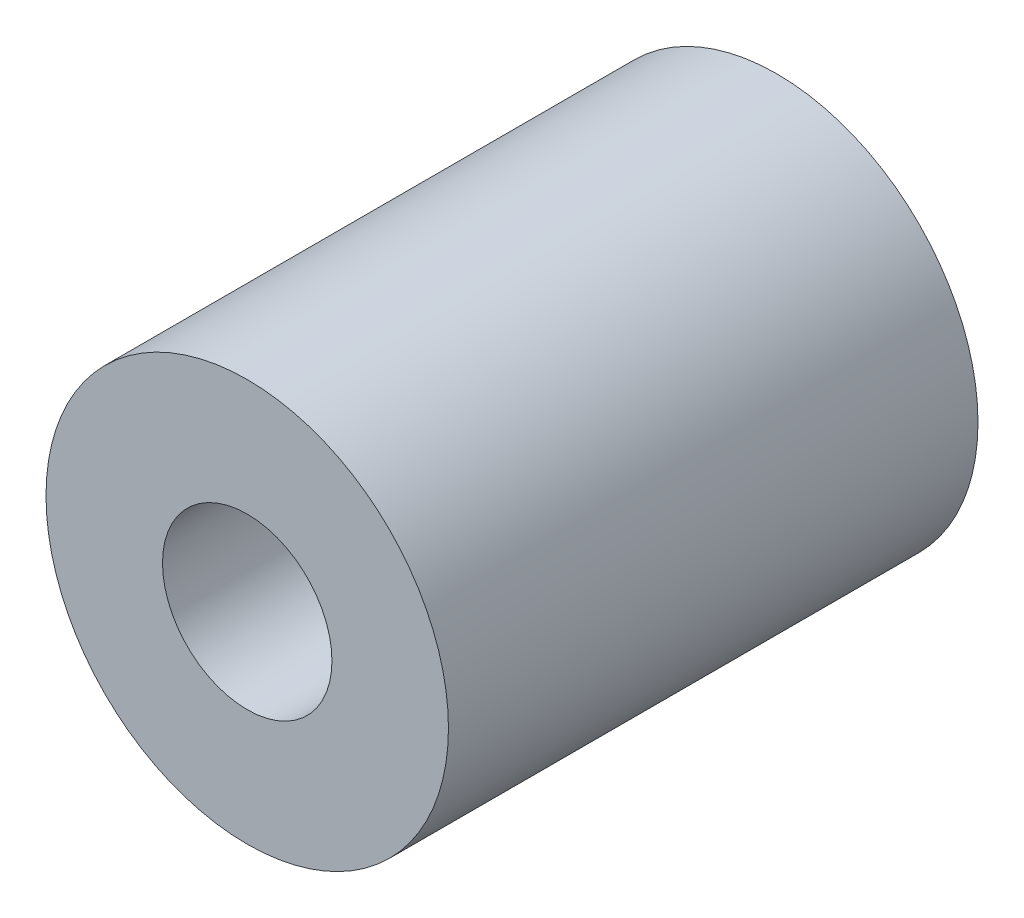
from build123d import *

# Parameters (mm, degrees)
SKETCH1_R           = 9.5
BOSS_EXTRUDE1_DEPTH = 25
SKETCH2_R           = 4
CUT_EXTRUDE1_DEPTH  = 12
SKETCH3_R           = 2.5
CUT_EXTRUDE2_DEPTH  = 13


with BuildPart() as part:
    # Sketch1 → Boss-Extrude1 (new body)
    with BuildSketch(Plane.XY):
        Circle(SKETCH1_R)
    extrude(amount=BOSS_EXTRUDE1_DEPTH)

    # Sketch2 → Cut-Extrude1 (cut)
    with BuildSketch(Plane.XY.offset(25)):
        Circle(SKETCH2_R)
    extrude(amount=-CUT_EXTRUDE1_DEPTH, mode=Mode.SUBTRACT)

    # Sketch3 → Cut-Extrude2 (cut)
    with BuildSketch(Plane(origin=(0, 0, 0), x_dir=(-1, 0, 0), z_dir=(0, 0, -1))):
        Circle(SKETCH3_R)
    extrude(amount=-CUT_EXTRUDE2_DEPTH, mode=Mode.SUBTRACT)


solid = part.part
